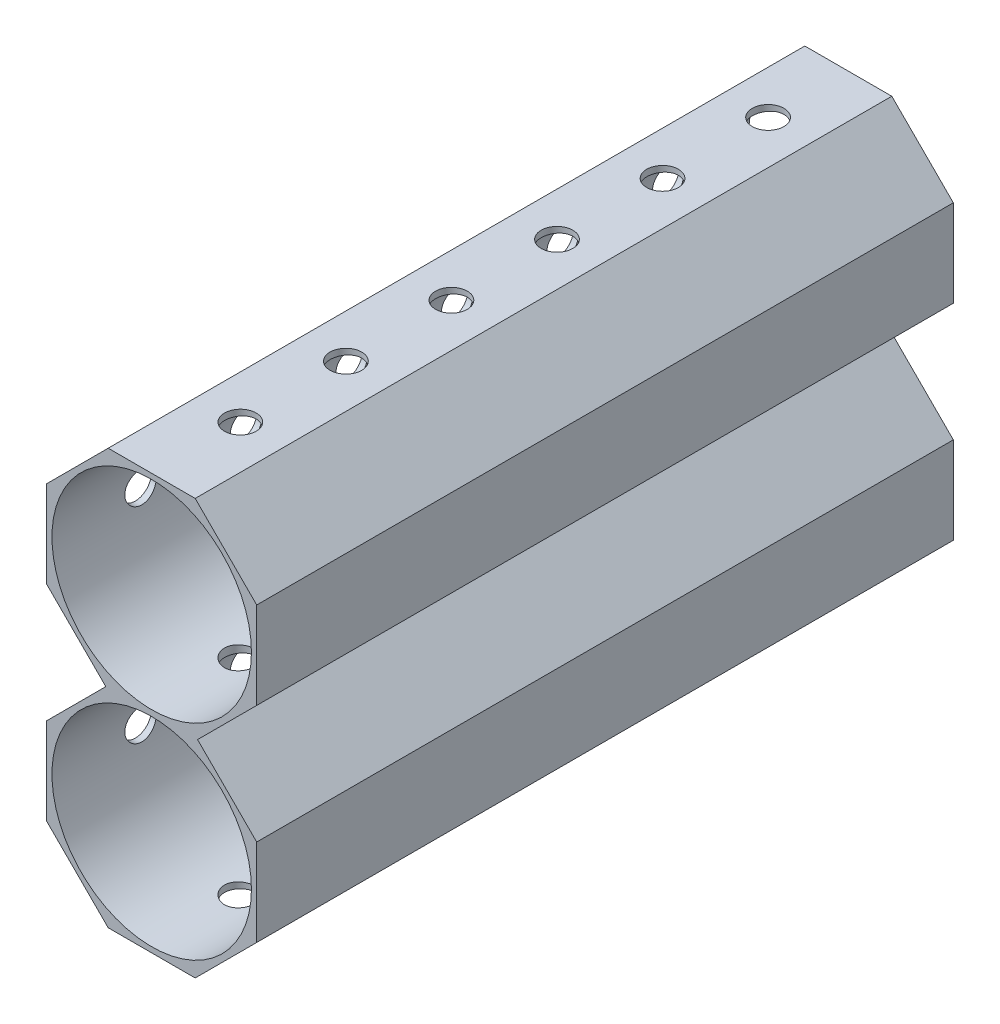
from build123d import *

# Parameters (mm, degrees)
SKIZZE1_R                       = 9.45
AUFSATZ_LINEAR_AUSTRAGEN1_DEPTH = 66
SKIZZE3_R                       = 1.5
SCHNITT_LINEAR_AUSTRAGEN3_DEPTH = 1
SKIZZE4_R                       = 1.5
SCHNITT_LINEAR_AUSTRAGEN4_DEPTH = 1
SKIZZE6_R                       = 1.5
SCHNITT_LINEAR_AUSTRAGEN5_DEPTH = 77.04554119
SKIZZE7_R                       = 1.5
SCHNITT_LINEAR_AUSTRAGEN6_DEPTH = 72.726395406
SKIZZE8_R                       = 1.5
SCHNITT_LINEAR_AUSTRAGEN7_DEPTH = 78.481772148


with BuildPart() as part:
    # Skizze1 → Aufsatz-Linear austragen1 (new body)
    with BuildSketch(Plane(origin=(0, 0, 0), x_dir=(0, 1, 0), z_dir=(0, 0, 1))):
        Polygon((9.725, 4.346424946), (4.121424946, 9.95), (-4.121424946, 9.95), (-9.95, 4.121424946), (-9.95, -4.121424946), (-4.121424946, -9.95), (4.121424946, -9.95), (9.725, -4.346424946), (15.328575054, -9.95), (23.571424946, -9.95), (29.4, -4.121424946), (29.4, 4.121424946), (23.571424946, 9.95), (15.328575054, 9.95), align=None)
        with Locations(Location((0, 0, 0), (0, 0, 270))):
            Circle(SKIZZE1_R, mode=Mode.SUBTRACT)
        with Locations(Location((19.45, 0, 0), (0, 0, 270))):
            Circle(SKIZZE1_R, mode=Mode.SUBTRACT)
    extrude(amount=AUFSATZ_LINEAR_AUSTRAGEN1_DEPTH)

    # Skizze3 → Schnitt-Linear austragen3 (cut)
    with BuildSketch(Plane(origin=(-9.95, 0, 0), x_dir=(0, -1, 0), z_dir=(-1, 0, 0))):
        with Locations((0, 57.6)):
            Circle(SKIZZE3_R)
        with Locations((0, 47.6)):
            Circle(SKIZZE3_R)
        with Locations((0, 37.6)):
            Circle(SKIZZE3_R)
        with Locations((0, 27.6)):
            Circle(SKIZZE3_R)
        with Locations((0, 17.6)):
            Circle(SKIZZE3_R)
        with Locations((0, 7.6)):
            Circle(SKIZZE3_R)
    extrude(amount=-SCHNITT_LINEAR_AUSTRAGEN3_DEPTH, mode=Mode.SUBTRACT)

    # Skizze4 → Schnitt-Linear austragen4 (cut)
    with BuildSketch(Plane(origin=(-9.95, 0, 0), x_dir=(0, -1, 0), z_dir=(-1, 0, 0))):
        with Locations((-19.45, 57.6)):
            Circle(SKIZZE4_R)
        with Locations((-19.45, 47.6)):
            Circle(SKIZZE4_R)
        with Locations((-19.45, 37.6)):
            Circle(SKIZZE4_R)
        with Locations((-19.45, 27.6)):
            Circle(SKIZZE4_R)
        with Locations((-19.45, 17.6)):
            Circle(SKIZZE4_R)
        with Locations((-19.45, 7.6)):
            Circle(SKIZZE4_R)
    extrude(amount=-SCHNITT_LINEAR_AUSTRAGEN4_DEPTH, mode=Mode.SUBTRACT)

    # Skizze6 → Schnitt-Linear austragen5 (cut, through all)
    with BuildSketch(Plane(origin=(-16.760712473, 16.760712473, 0), x_dir=(-0.7071067811865475, -0.7071067811865476, 0), z_dir=(-0.7071067811865476, 0.7071067811865475, 0))):
        with Locations((-13.753226894, 57.6)):
            Circle(SKIZZE6_R)
        with Locations((-13.753226894, 47.6)):
            Circle(SKIZZE6_R)
        with Locations((-13.753226894, 37.6)):
            Circle(SKIZZE6_R)
        with Locations((-13.753226894, 27.6)):
            Circle(SKIZZE6_R)
        with Locations((-13.753226894, 17.6)):
            Circle(SKIZZE6_R)
        with Locations((-13.753226894, 7.6)):
            Circle(SKIZZE6_R)
    extrude(amount=-SCHNITT_LINEAR_AUSTRAGEN5_DEPTH, mode=Mode.SUBTRACT)

    # Skizze7 → Schnitt-Linear austragen6 (cut, through all)
    with BuildSketch(Plane(origin=(-7.035712473, 7.035712473, 0), x_dir=(-0.707106781186547, -0.707106781186548, 0), z_dir=(-0.707106781186548, 0.707106781186547, 0))):
        with Locations((0.138850059, 57.6)):
            Circle(SKIZZE7_R)
        with Locations((0.114744216, 47.600029055)):
            Circle(SKIZZE7_R)
        with Locations((0.090638373, 37.600058109)):
            Circle(SKIZZE7_R)
        with Locations((0.06653253, 27.600087164)):
            Circle(SKIZZE7_R)
        with Locations((0.042426687, 17.600116219)):
            Circle(SKIZZE7_R)
        with Locations((0.018320844, 7.600145273)):
            Circle(SKIZZE7_R)
    extrude(amount=-SCHNITT_LINEAR_AUSTRAGEN6_DEPTH, mode=Mode.SUBTRACT)

    # Skizze8 → Schnitt-Linear austragen7 (cut, through all)
    with BuildSketch(Plane(origin=(0, 29.4, 0), x_dir=(-1, 0, 0), z_dir=(0, 1, 0))):
        with Locations((0, 57.6)):
            Circle(SKIZZE8_R)
        with Locations((0, 47.6)):
            Circle(SKIZZE8_R)
        with Locations((0, 37.6)):
            Circle(SKIZZE8_R)
        with Locations((0, 27.6)):
            Circle(SKIZZE8_R)
        with Locations((0, 17.6)):
            Circle(SKIZZE8_R)
        with Locations((0, 7.6)):
            Circle(SKIZZE8_R)
    extrude(amount=-SCHNITT_LINEAR_AUSTRAGEN7_DEPTH, mode=Mode.SUBTRACT)


solid = part.part
